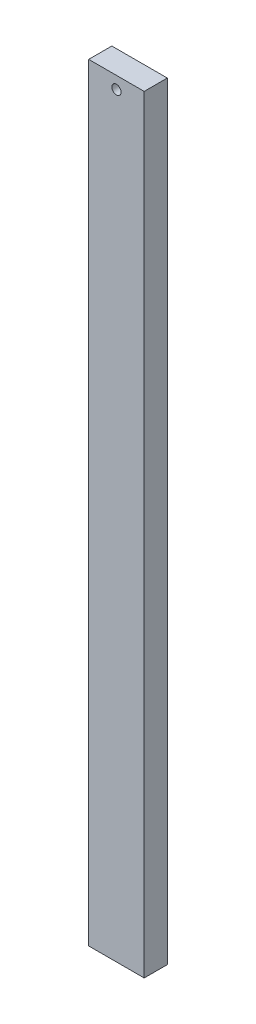
from build123d import *

# Parameters (mm, degrees)
SKETCH_1_W          = 36
SKETCH_1_H          = 15
EXTRUDE_1_DEPTH     = 498.33
SKETCH_2_R          = 3
CUT_EXTRUDE_1_DEPTH = 499.8805357


with BuildPart() as part:
    # 草图1 → 凸台-拉伸1 (new body)
    with BuildSketch(Plane(origin=(0, 0, 0), x_dir=(1, 0, 0), z_dir=(0, 1, 0))):
        Rectangle(SKETCH_1_W, SKETCH_1_H)
    extrude(amount=EXTRUDE_1_DEPTH)

    # 草图2 → 切除-拉伸1 (cut, through all)
    with BuildSketch(Plane.XY.offset(7.5)):
        with Locations((0, 490.33)):
            Circle(SKETCH_2_R)
    extrude(amount=-CUT_EXTRUDE_1_DEPTH, mode=Mode.SUBTRACT)


solid = part.part
